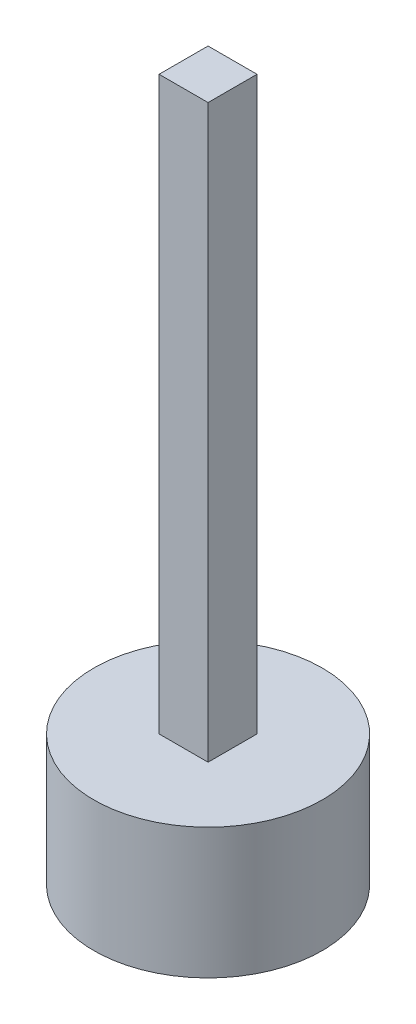
from build123d import *

# Parameters (mm, degrees)
SKETCH1_W           = 30
SKETCH1_H           = 30
BOSS_EXTRUDE1_DEPTH = 350
SKETCH2_R           = 70
BOSS_EXTRUDE2_DEPTH = 80


with BuildPart() as part:
    # Sketch1 → Boss-Extrude1 (new body)
    with BuildSketch(Plane(origin=(0, 0, 0), x_dir=(1, 0, 0), z_dir=(0, 1, 0))):
        with Locations((0, 15)):
            Rectangle(SKETCH1_W, SKETCH1_H)
    extrude(amount=-BOSS_EXTRUDE1_DEPTH)

    # Sketch2 → Boss-Extrude2 (add)
    with BuildSketch(Plane.XZ.offset(350)):
        with Locations(Location((0, -15, 0), (0, 0, 270))):
            Circle(SKETCH2_R)
    extrude(amount=BOSS_EXTRUDE2_DEPTH)


solid = part.part
